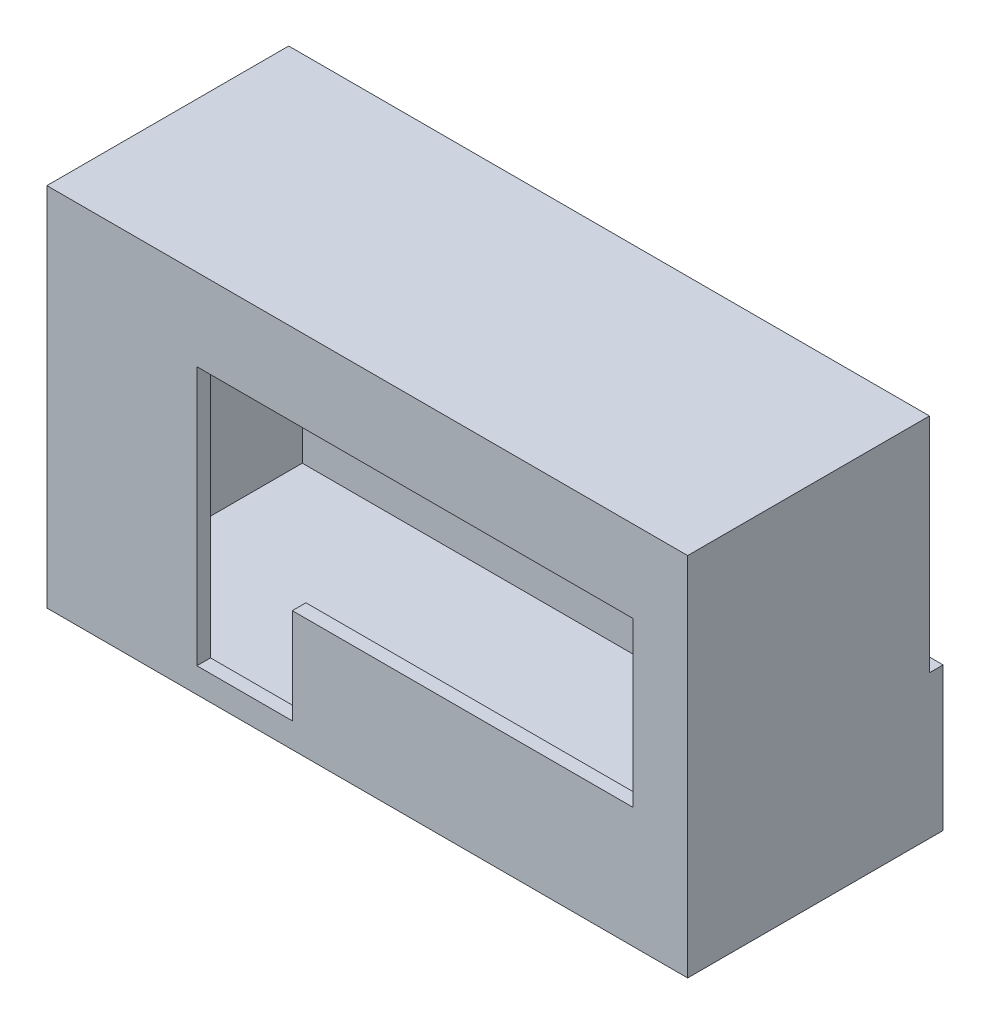
from build123d import *

# Parameters (mm, degrees)
SKETCH_16_W      = 4500
SKETCH_16_H      = 2500
EXTRUDE_5_DEPTH  = 100
SKETCH_19_W      = 1773.504419248
SKETCH_19_H      = 83.501937027
EXTRUDE_6_DEPTH  = 4500
SKETCH_20_W      = 1773.504419248
SKETCH_20_H      = 2583.501937027
EXTRUDE_7_DEPTH  = 100
SKETCH_21_W      = 1773.504419248
SKETCH_21_H      = 2583.501937027
EXTRUDE_8_DEPTH  = 100
SKETCH_22_W      = 4700
SKETCH_22_H      = 1773.504419248
EXTRUDE_9_DEPTH  = 100
SKETCH_23_W      = 4700
SKETCH_23_H      = 1052.282115433
EXTRUDE_10_DEPTH = 100


with BuildPart() as part:
    # Эскиз16 → Бобышка-Вытянуть5 (new body)
    with BuildSketch(Plane.XY):
        with Locations((-2250, 1250)):
            Rectangle(SKETCH_16_W, SKETCH_16_H)
        Polygon((-2800, 100), (-3500, 100), (-3500, 2000), (-2800, 2000), (-300, 2000), (-300, 800), (-2800, 800), align=None, mode=Mode.SUBTRACT)
    extrude(amount=EXTRUDE_5_DEPTH)

    # Эскиз19 → Бобышка-Вытянуть6 (add)
    with BuildSketch(Plane(origin=(0, 0, 0), x_dir=(0, 0, -1), z_dir=(1, 0, 0))):
        with Locations((786.752209624, -41.750968514)):
            Rectangle(SKETCH_19_W, SKETCH_19_H)
    extrude(amount=-EXTRUDE_6_DEPTH)

    # Эскиз20 → Бобышка-Вытянуть7 (add)
    with BuildSketch(Plane(origin=(0, 0, 0), x_dir=(0, 0, -1), z_dir=(1, 0, 0))):
        with Locations((786.752209624, 1208.249031486)):
            Rectangle(SKETCH_20_W, SKETCH_20_H)
    extrude(amount=EXTRUDE_7_DEPTH)

    # Эскиз21 → Бобышка-Вытянуть8 (add)
    with BuildSketch(Plane.ZY.offset(4500)):
        with Locations((-786.752209624, 1208.249031486)):
            Rectangle(SKETCH_21_W, SKETCH_21_H)
    extrude(amount=EXTRUDE_8_DEPTH)

    # Эскиз22 → Бобышка-Вытянуть9 (add)
    with BuildSketch(Plane(origin=(0, 2500, 0), x_dir=(1, 0, 0), z_dir=(0, 1, 0))):
        with Locations((-2250, 786.752209624)):
            Rectangle(SKETCH_22_W, SKETCH_22_H)
    extrude(amount=EXTRUDE_9_DEPTH)

    # Эскиз23 → Бобышка-Вытянуть10 (add)
    with BuildSketch(Plane(origin=(0, 0, -1673.504419248), x_dir=(-1, 0, 0), z_dir=(0, 0, -1))):
        with Locations((2250, 442.639120689)):
            Rectangle(SKETCH_23_W, SKETCH_23_H)
    extrude(amount=EXTRUDE_10_DEPTH)


solid = part.part
